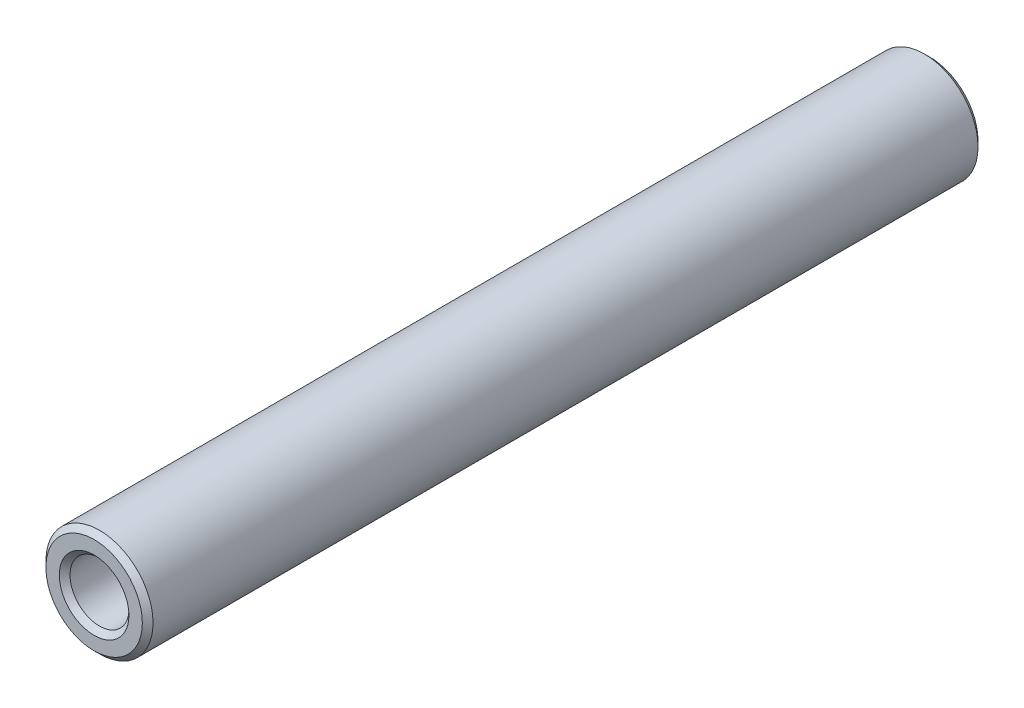
from build123d import *

# Parameters (mm, degrees)
SKETCH1_R           = 5
SKETCH1_R_2         = 2.75
BOSS_EXTRUDE1_DEPTH = 39
CHAMFER1_SIZE       = 0.5
CHAMFER2_SIZE       = 0.5


with BuildPart() as part:
    # Sketch1 → Boss-Extrude1 (new, symmetric)
    with BuildSketch(Plane(origin=(0, 0, 0), x_dir=(0, 1, 0), z_dir=(0, 0, 1))):
        with Locations(Location((0, 0, 0), (0, 0, 270))):
            Circle(SKETCH1_R)
        with Locations(Location((0, 0, 0), (0, 0, 270))):
            Circle(SKETCH1_R_2, mode=Mode.SUBTRACT)
    extrude(amount=BOSS_EXTRUDE1_DEPTH, both=True)

    # Chamfer1
    chamfer1_edges = [part.edges().sort_by_distance(p)[0] for p in [
        (-2.75, 0, -39),
        (-2.75, 0, 39),
    ]]
    chamfer(chamfer1_edges, length=CHAMFER1_SIZE)

    # Chamfer2
    chamfer2_edges = [part.edges().sort_by_distance(p)[0] for p in [
        (-5, 0, -39),
        (-5, 0, 39),
    ]]
    chamfer(chamfer2_edges, length=CHAMFER2_SIZE)


solid = part.part
